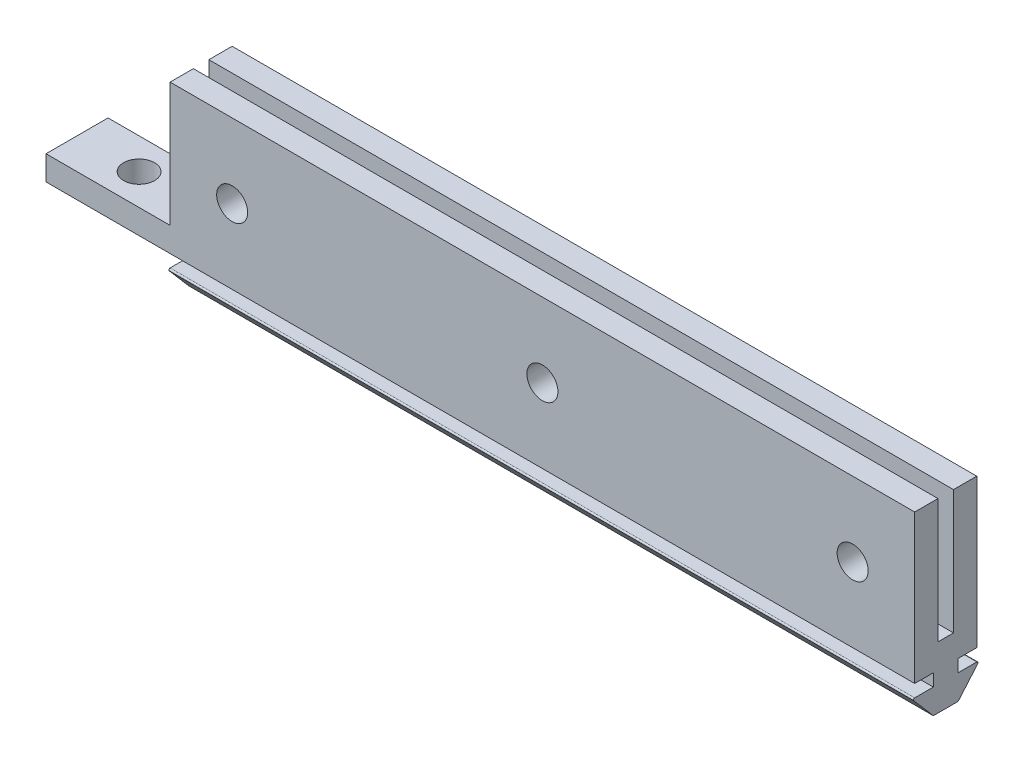
from build123d import *

# Parameters (mm, degrees)
SKETCH10_W                  = 2.54
SKETCH10_H                  = 2.54
BOSS_EXTRUDE3_DEPTH         = 152.4
BOSS_EXTRUDE4_DEPTH         = 177.8
SKETCH14_W                  = 25.4
SKETCH14_H                  = 25.4
CUT_EXTRUDE1_DEPTH          = 184.407350223
F_1_4_0_25_DIAMETER_HOLE1_D = 6.35
F_1_4_0_25_DIAMETER_HOLE2_D = 6.35


with BuildPart() as part:
    # Sketch10 → Boss-Extrude3 (new body)
    with BuildSketch(Plane(origin=(0, 0, 0), x_dir=(0, 0, -1), z_dir=(1, 0, 0))):
        with BuildLine():
            Line((-2.54, 5.08), (0, 5.08))
            Line((0, 5.08), (0, 10.16))
            Line((0, 10.16), (-2.54, 10.16))
            Line((-2.54, 10.16), (-6.35, 10.16))
            ThreePointArc((-6.35, 10.16), (-6.580814495, 10.012022021), (-6.542688341, 9.740509205))
            Line((-6.542688341, 9.740509205), (-2.54, 5.08))
        make_face()
        with Locations((-1.27, 11.43)):
            Rectangle(SKETCH10_W, SKETCH10_H)
        with BuildLine():
            Line((0, 10.16), (0, 5.08))
            Line((0, 5.08), (2.54, 5.08))
            Line((2.54, 5.08), (6.542688341, 9.740509205))
            ThreePointArc((6.542688341, 9.740509205), (6.580814495, 10.012022021), (6.35, 10.16))
            Line((6.35, 10.16), (2.54, 10.16))
            Line((2.54, 10.16), (0, 10.16))
        make_face()
        with Locations((1.27, 11.43)):
            Rectangle(SKETCH10_W, SKETCH10_H)
    extrude(amount=-BOSS_EXTRUDE3_DEPTH)

    # Sketch11 → Boss-Extrude4 (add)
    with BuildSketch(Plane(origin=(0, 0, 0), x_dir=(0, 0, -1), z_dir=(1, 0, 0))):
        Polygon((6.35, 12.7), (-6.35, 12.7), (-6.35, 43.1), (-1.5875, 43.1), (-1.5875, 17.7), (1.5875, 17.7), (1.5875, 43.1), (6.35, 43.1), align=None)
    extrude(amount=-BOSS_EXTRUDE4_DEPTH)

    # Sketch14 → Cut-Extrude1 (cut, through all)
    with BuildSketch(Plane(origin=(0, 0, -6.35), x_dir=(-1, 0, 0), z_dir=(0, 0, -1))):
        with Locations((165.1, 30.4)):
            Rectangle(SKETCH14_W, SKETCH14_H)
    extrude(amount=-CUT_EXTRUDE1_DEPTH, mode=Mode.SUBTRACT)

    # 1/4 (0.25) Diameter Hole1 (through all)
    with Locations(Plane(origin=(0, 0, -6.35), x_dir=(-1, 0, 0), z_dir=(0, 0, -1))):
        with Locations((139.7, 27.9), (12.7, 27.9), (76.2, 27.9)):
            Hole(F_1_4_0_25_DIAMETER_HOLE1_D / 2)

    # 1/4 (0.25) Diameter Hole2 (through all)
    with Locations(Plane(origin=(0, 17.7, 0), x_dir=(1, 0, 0), z_dir=(0, 1, 0))):
        with Locations((-165.1, 0)):
            Hole(F_1_4_0_25_DIAMETER_HOLE2_D / 2)


solid = part.part
